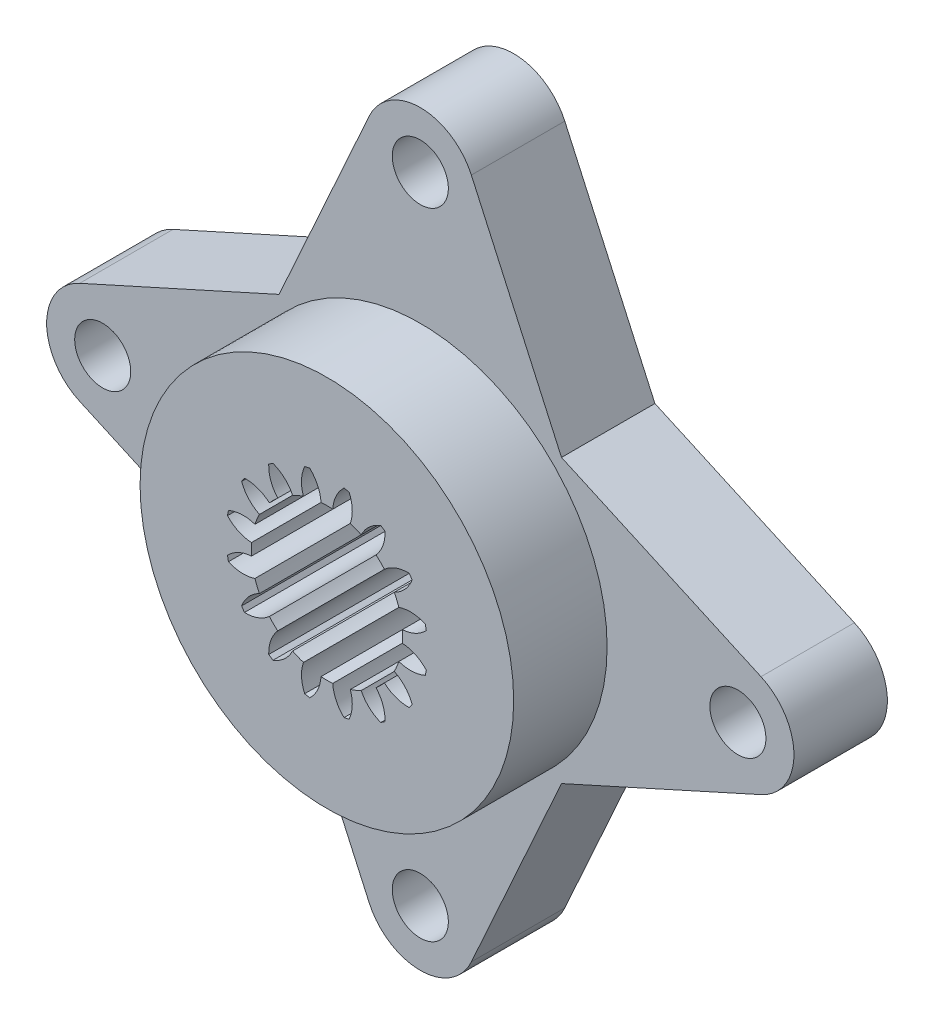
from build123d import *

# Parameters (mm, degrees)
CROQUIS1_R                 = 10
CROQUIS1_R_2               = 2
SALIENTE_EXTRUIR1_DEPTH    = 10
CORTAR_EXTRUIR1_DEPTH      = 10
CORTAR_EXTRUIR1_DEPTH_BACK = 20
CROQUIS3_R                 = 1.5
CROQUIS3_R_2               = 10
SALIENTE_EXTRUIR2_DEPTH    = 5


with BuildPart() as part:
    # Croquis1 → Saliente-Extruir1 (new body)
    with BuildSketch(Plane.XY):
        Circle(CROQUIS1_R)
        Circle(CROQUIS1_R_2, mode=Mode.SUBTRACT)
    extrude(amount=SALIENTE_EXTRUIR1_DEPTH)

    # Croquis2 → Cortar-Extruir1 (cut, two sides: drawn at the far end of the back side and taken through both)
    with BuildSketch(Plane.XY.offset(10).offset(-CORTAR_EXTRUIR1_DEPTH_BACK)):
        with BuildLine():
            Line((0.91835658, 5.32133641), (1.187936434, 5.267713643))
            ThreePointArc((1.187936434, 5.267713643), (1.356901071, 4.56513254), (1.254199065, 3.849855284))
            ThreePointArc((1.254199065, 3.849855284), (1.549485218, 3.740788227), (1.835406113, 3.609111442))
            ThreePointArc((1.835406113, 3.609111442), (2.268562227, 4.187510125), (2.88483813, 4.564833947))
            Line((2.88483813, 4.564833947), (3.113376895, 4.412129226))
            ThreePointArc((3.113376895, 4.412129226), (3.000613717, 3.698368958), (2.63200468, 3.076841296))
            ThreePointArc((2.63200468, 3.076841296), (2.863075357, 2.863075357), (3.076841296, 2.63200468))
            ThreePointArc((3.076841296, 2.63200468), (3.698368958, 3.000613717), (4.412129226, 3.113376895))
            Line((4.412129226, 3.113376895), (4.564833947, 2.88483813))
            ThreePointArc((4.564833947, 2.88483813), (4.187510125, 2.268562227), (3.609111442, 1.835406113))
            ThreePointArc((3.609111442, 1.835406113), (3.740788227, 1.549485218), (3.849855284, 1.254199065))
            ThreePointArc((3.849855284, 1.254199065), (4.56513254, 1.356901071), (5.267713643, 1.187936434))
            Line((5.267713643, 1.187936434), (5.32133641, 0.91835658))
            ThreePointArc((5.32133641, 0.91835658), (4.736896076, 0.493387462), (4.036763703, 0.314546988))
            ThreePointArc((4.036763703, 0.314546988), (4.049, 0), (4.036763703, -0.314546988))
            ThreePointArc((4.036763703, -0.314546988), (4.736896076, -0.493387462), (5.32133641, -0.91835658))
            Line((5.32133641, -0.91835658), (5.267713643, -1.187936434))
            ThreePointArc((5.267713643, -1.187936434), (4.56513254, -1.356901071), (3.849855284, -1.254199065))
            ThreePointArc((3.849855284, -1.254199065), (3.740788227, -1.549485218), (3.609111442, -1.835406113))
            ThreePointArc((3.609111442, -1.835406113), (4.187510125, -2.268562227), (4.564833947, -2.88483813))
            Line((4.564833947, -2.88483813), (4.412129226, -3.113376895))
            ThreePointArc((4.412129226, -3.113376895), (3.698368958, -3.000613717), (3.076841296, -2.63200468))
            ThreePointArc((3.076841296, -2.63200468), (2.863075357, -2.863075357), (2.63200468, -3.076841296))
            ThreePointArc((2.63200468, -3.076841296), (3.000613717, -3.698368958), (3.113376895, -4.412129226))
            Line((3.113376895, -4.412129226), (2.88483813, -4.564833947))
            ThreePointArc((2.88483813, -4.564833947), (2.268562227, -4.187510125), (1.835406113, -3.609111442))
            ThreePointArc((1.835406113, -3.609111442), (1.549485218, -3.740788227), (1.254199065, -3.849855284))
            ThreePointArc((1.254199065, -3.849855284), (1.356901071, -4.56513254), (1.187936434, -5.267713643))
            Line((1.187936434, -5.267713643), (0.91835658, -5.32133641))
            ThreePointArc((0.91835658, -5.32133641), (0.493387462, -4.736896076), (0.314546988, -4.036763703))
            ThreePointArc((0.314546988, -4.036763703), (0, -4.049), (-0.314546988, -4.036763703))
            ThreePointArc((-0.314546988, -4.036763703), (-0.493387462, -4.736896076), (-0.91835658, -5.32133641))
            Line((-0.91835658, -5.32133641), (-1.187936434, -5.267713643))
            ThreePointArc((-1.187936434, -5.267713643), (-1.356901071, -4.56513254), (-1.254199065, -3.849855284))
            ThreePointArc((-1.254199065, -3.849855284), (-1.549485218, -3.740788227), (-1.835406113, -3.609111442))
            ThreePointArc((-1.835406113, -3.609111442), (-2.268562227, -4.187510125), (-2.88483813, -4.564833947))
            Line((-2.88483813, -4.564833947), (-3.113376895, -4.412129226))
            ThreePointArc((-3.113376895, -4.412129226), (-3.000613717, -3.698368958), (-2.63200468, -3.076841296))
            ThreePointArc((-2.63200468, -3.076841296), (-2.863075357, -2.863075357), (-3.076841296, -2.63200468))
            ThreePointArc((-3.076841296, -2.63200468), (-3.698368958, -3.000613717), (-4.412129226, -3.113376895))
            Line((-4.412129226, -3.113376895), (-4.564833947, -2.88483813))
            ThreePointArc((-4.564833947, -2.88483813), (-4.187510125, -2.268562227), (-3.609111442, -1.835406113))
            ThreePointArc((-3.609111442, -1.835406113), (-3.740788227, -1.549485218), (-3.849855284, -1.254199065))
            ThreePointArc((-3.849855284, -1.254199065), (-4.56513254, -1.356901071), (-5.267713643, -1.187936434))
            Line((-5.267713643, -1.187936434), (-5.32133641, -0.91835658))
            ThreePointArc((-5.32133641, -0.91835658), (-4.736896076, -0.493387462), (-4.036763703, -0.314546988))
            ThreePointArc((-4.036763703, -0.314546988), (-4.049, 0), (-4.036763703, 0.314546988))
            ThreePointArc((-4.036763703, 0.314546988), (-4.736896076, 0.493387462), (-5.32133641, 0.91835658))
            Line((-5.32133641, 0.91835658), (-5.267713643, 1.187936434))
            ThreePointArc((-5.267713643, 1.187936434), (-4.56513254, 1.356901071), (-3.849855284, 1.254199065))
            ThreePointArc((-3.849855284, 1.254199065), (-3.740788227, 1.549485218), (-3.609111442, 1.835406113))
            ThreePointArc((-3.609111442, 1.835406113), (-4.187510125, 2.268562227), (-4.564833947, 2.88483813))
            Line((-4.564833947, 2.88483813), (-4.412129226, 3.113376895))
            ThreePointArc((-4.412129226, 3.113376895), (-3.698368958, 3.000613717), (-3.076841296, 2.63200468))
            ThreePointArc((-3.076841296, 2.63200468), (-2.863075357, 2.863075357), (-2.63200468, 3.076841296))
            ThreePointArc((-2.63200468, 3.076841296), (-3.000613717, 3.698368958), (-3.113376895, 4.412129226))
            Line((-3.113376895, 4.412129226), (-2.88483813, 4.564833947))
            ThreePointArc((-2.88483813, 4.564833947), (-2.268562227, 4.187510125), (-1.835406113, 3.609111442))
            ThreePointArc((-1.835406113, 3.609111442), (-1.549485218, 3.740788227), (-1.254199065, 3.849855284))
            ThreePointArc((-1.254199065, 3.849855284), (-1.356901071, 4.56513254), (-1.187936434, 5.267713643))
            Line((-1.187936434, 5.267713643), (-0.91835658, 5.32133641))
            ThreePointArc((-0.91835658, 5.32133641), (-0.493387462, 4.736896076), (-0.314546988, 4.036763703))
            ThreePointArc((-0.314546988, 4.036763703), (0, 4.049), (0.314546988, 4.036763703))
            ThreePointArc((0.314546988, 4.036763703), (0.493387462, 4.736896076), (0.91835658, 5.32133641))
        make_face()
    extrude(amount=CORTAR_EXTRUIR1_DEPTH + CORTAR_EXTRUIR1_DEPTH_BACK, mode=Mode.SUBTRACT)

    # Croquis3 → Saliente-Extruir2 (add)
    with BuildSketch(Plane(origin=(0, 0, 0), x_dir=(-1, 0, 0), z_dir=(0, 0, -1))):
        with BuildLine():
            Line((-2.733870597, 18.235294118), (-7.558265316, 7.558265316))
            Line((-7.558265316, 7.558265316), (-18.235294118, 2.733870597))
            ThreePointArc((-18.235294118, 2.733870597), (-20, 0), (-18.235294118, -2.733870597))
            Line((-18.235294118, -2.733870597), (-7.558265316, -7.558265316))
            Line((-7.558265316, -7.558265316), (-2.733870597, -18.235294118))
            ThreePointArc((-2.733870597, -18.235294118), (0, -20), (2.733870597, -18.235294118))
            Line((2.733870597, -18.235294118), (7.558265316, -7.558265316))
            Line((7.558265316, -7.558265316), (18.235294118, -2.733870597))
            ThreePointArc((18.235294118, -2.733870597), (20, 0), (18.235294118, 2.733870597))
            Line((18.235294118, 2.733870597), (7.558265316, 7.558265316))
            Line((7.558265316, 7.558265316), (2.733870597, 18.235294118))
            ThreePointArc((2.733870597, 18.235294118), (0, 20), (-2.733870597, 18.235294118))
        make_face()
        with Locations((0, 17)):
            Circle(CROQUIS3_R, mode=Mode.SUBTRACT)
        with Locations((17, 0)):
            Circle(CROQUIS3_R, mode=Mode.SUBTRACT)
        Circle(CROQUIS3_R_2, mode=Mode.SUBTRACT)
        with Locations((0, -17)):
            Circle(CROQUIS3_R, mode=Mode.SUBTRACT)
        with Locations((-17, 0)):
            Circle(CROQUIS3_R, mode=Mode.SUBTRACT)
    extrude(amount=-SALIENTE_EXTRUIR2_DEPTH)


solid = part.part
